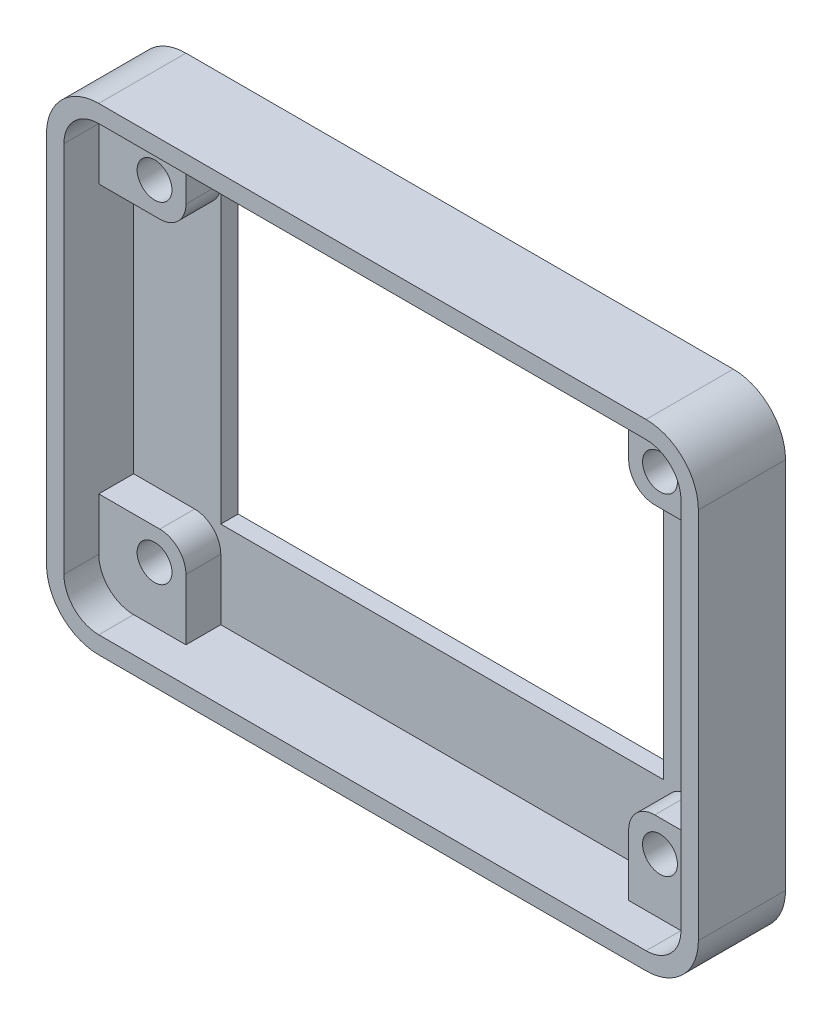
from build123d import *

# Parameters (mm, degrees)
SKETCH_1_W          = 37.4
SKETCH_1_H          = 27.4
EXTRUDE_1_DEPTH     = 5
FILLET_1_R          = 3
SHELL_1_T           = -1
SKETCH_2_W          = 25.4
SKETCH_2_H          = 17.4
CUT_EXTRUDE_1_DEPTH = 10
EXTRUDE_2_DEPTH     = 2
SKETCH_4_R          = 1
CUT_EXTRUDE_2_DEPTH = 24.714552494


with BuildPart() as part:
    # 草图1 → 凸台-拉伸1 (new body)
    with BuildSketch(Plane.XY):
        Rectangle(SKETCH_1_W, SKETCH_1_H)
    extrude(amount=EXTRUDE_1_DEPTH)

    # 圆角1
    fillet_1_edges = [part.edges().sort_by_distance(p)[0] for p in [
        (18.7, -13.7, 2.5),
        (-18.7, -13.7, 2.5),
        (-18.7, 13.7, 2.5),
        (18.7, 13.7, 2.5),
    ]]
    fillet(fillet_1_edges, radius=FILLET_1_R)

    # 抽壳1
    shell_1_openings = [part.faces().sort_by_distance(p)[0] for p in [
        (0, 0, 5),
    ]]
    offset(amount=SHELL_1_T, openings=shell_1_openings, kind=Kind.INTERSECTION)

    # 草图2 → 切除-拉伸1 (cut)
    with BuildSketch(Plane(origin=(0, 0, 0), x_dir=(-1, 0, 0), z_dir=(0, 0, -1))):
        with Locations((0, 1)):
            Rectangle(SKETCH_2_W, SKETCH_2_H)
    extrude(amount=-CUT_EXTRUDE_1_DEPTH, mode=Mode.SUBTRACT)

    # 草图3 → 凸台-拉伸2 (add)
    with BuildSketch(Plane.XY.offset(1)):
        with BuildLine():
            Line((-17.7, -7.7), (-14.2, -7.7))
            ThreePointArc((-14.2, -7.7), (-13.139339828, -8.139339828), (-12.7, -9.2))
            Line((-12.7, -9.2), (-12.7, -12.7))
            Line((-12.7, -12.7), (-17.7, -12.7))
            Line((-17.7, -12.7), (-17.7, -7.7))
        make_face()
        with BuildLine():
            Line((12.7, -9.2), (12.7, -12.7))
            Line((12.7, -12.7), (17.7, -12.7))
            Line((17.7, -12.7), (17.7, -7.7))
            Line((17.7, -7.7), (14.2, -7.7))
            ThreePointArc((14.2, -7.7), (13.139339828, -8.139339828), (12.7, -9.2))
        make_face()
        with BuildLine():
            Line((17.7, 7.7), (14.2, 7.7))
            ThreePointArc((14.2, 7.7), (13.139339828, 8.139339828), (12.7, 9.2))
            Line((12.7, 9.2), (12.7, 12.7))
            Line((12.7, 12.7), (17.7, 12.7))
            Line((17.7, 12.7), (17.7, 7.7))
        make_face()
        with BuildLine():
            Line((-12.7, 9.2), (-12.7, 12.7))
            Line((-12.7, 12.7), (-17.7, 12.7))
            Line((-17.7, 12.7), (-17.7, 7.7))
            Line((-17.7, 7.7), (-14.2, 7.7))
            ThreePointArc((-14.2, 7.7), (-13.139339828, 8.139339828), (-12.7, 9.2))
        make_face()
    extrude(amount=EXTRUDE_2_DEPTH)

    # 草图4 → 切除-拉伸2 (cut, through all)
    with BuildSketch(Plane(origin=(0, 0, 0), x_dir=(-1, 0, 0), z_dir=(0, 0, -1))):
        with Locations((14.5, -9.5)):
            Circle(SKETCH_4_R)
        with Locations((14.5, 9.5)):
            Circle(SKETCH_4_R)
        with Locations((-14.5, 9.5)):
            Circle(SKETCH_4_R)
        with Locations((-14.5, -9.5)):
            Circle(SKETCH_4_R)
    extrude(amount=-CUT_EXTRUDE_2_DEPTH, mode=Mode.SUBTRACT)


solid = part.part
